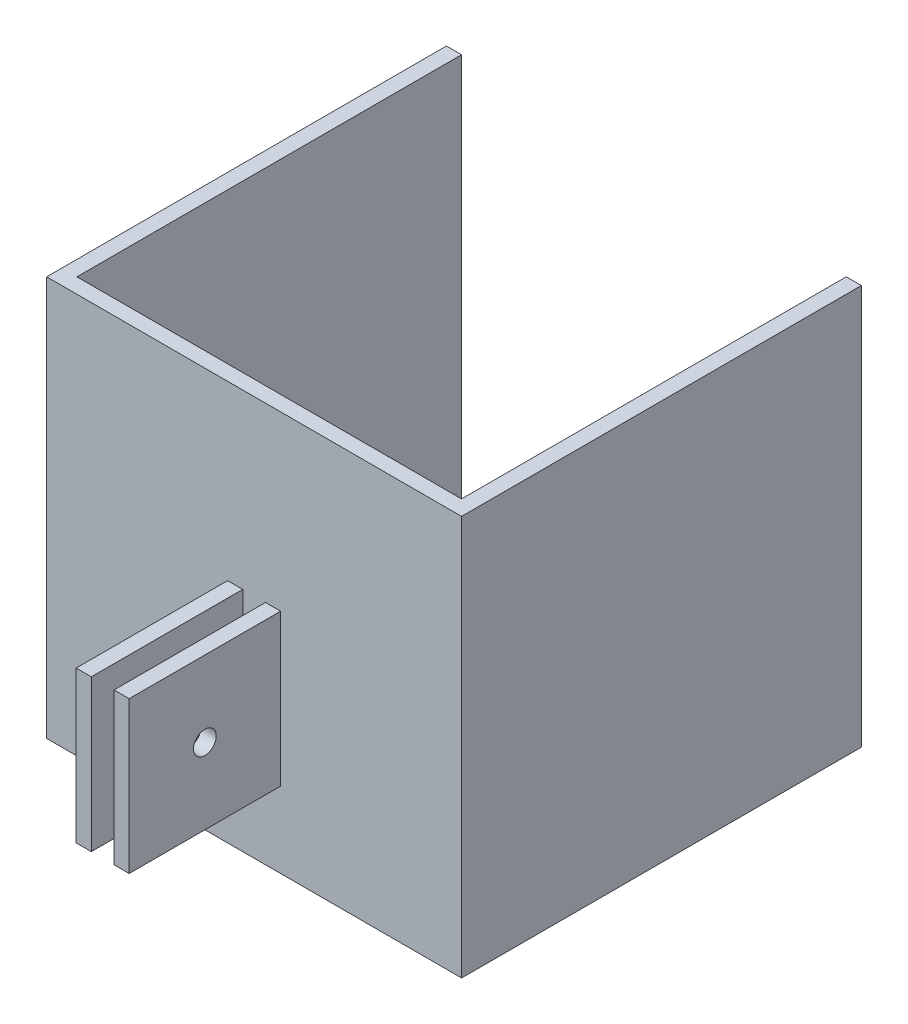
from build123d import *

# Parameters (mm, degrees)
SKETCH1_W                = 50.8
SKETCH1_H                = 50.8
BOSS_EXTRUDE1_DEPTH      = 2
BOSS_EXTRUDE2_START      = 2
BOSS_EXTRUDE2_DEPTH      = 50.8
BOSS_EXTRUDE3_DEPTH      = 10
BOSS_EXTRUDE3_DEPTH_BACK = 10
BOSS_EXTRUDE3_START      = 20
SKETCH1_4_W              = 2
SKETCH1_4_H              = 20
CUT_EXTRUDE1_REACH       = 81.519
SKETCH3_R                = 1.5


with BuildPart() as part:
    # Sketch1 → Boss-Extrude1 (new body)
    with BuildSketch(Plane(origin=(0, 0, 0), x_dir=(1, 0, 0), z_dir=(0, 1, 0))):
        Polygon((52.8, -2), (52.8, 50.8), (50.8, 50.8), (50.8, 0), (0, 0), (0, 50.8), (-2, 50.8), (-2, -2), align=None)
        with Locations((25.4, 25.4)):
            Rectangle(SKETCH1_W, SKETCH1_H)
    extrude(amount=BOSS_EXTRUDE1_DEPTH)

    # Sketch1<3> → Boss-Extrude2 (add)
    with BuildSketch(Plane(origin=(0, 0, 0), x_dir=(1, 0, 0), z_dir=(0, 1, 0)).offset(BOSS_EXTRUDE2_START)):
        Polygon((52.8, -2), (52.8, 50.8), (50.8, 50.8), (50.8, 0), (0, 0), (0, 50.8), (-2, 50.8), (-2, -2), align=None)
    extrude(amount=BOSS_EXTRUDE2_DEPTH)

    # Sketch1<4> → Boss-Extrude3 (add, two sides: drawn at the far end of the back side and taken through both)
    with BuildSketch(Plane(origin=(0, 0, 0), x_dir=(1, 0, 0), z_dir=(0, 1, 0)).offset(BOSS_EXTRUDE3_START - BOSS_EXTRUDE3_DEPTH_BACK)):
        with Locations((27.9, -12)):
            Rectangle(SKETCH1_4_W, SKETCH1_4_H)
        with Locations((22.9, -12)):
            Rectangle(SKETCH1_4_W, SKETCH1_4_H)
    extrude(amount=BOSS_EXTRUDE3_DEPTH + BOSS_EXTRUDE3_DEPTH_BACK)

    # Cut-Extrude1: up to this face of the body (flat: up to its plane)
    cut_extrude1_end = Plane(part.part.faces().sort_by_distance((21.9, 20, 12))[0])
    # Sketch3 → Cut-Extrude1 (cut, up to the picked face)
    with BuildSketch(Plane(origin=(28.9, 0, 0), x_dir=(0, 0, -1), z_dir=(1, 0, 0)), mode=Mode.PRIVATE) as cut_extrude1_sk1:
        with Locations((-12, 20)):
            Circle(SKETCH3_R)
    cut_extrude1_tool1 = split(extrude(cut_extrude1_sk1.sketch, amount=-CUT_EXTRUDE1_REACH, mode=Mode.PRIVATE), bisect_by=cut_extrude1_end, keep=Keep.BOTH, mode=Mode.PRIVATE)
    add(cut_extrude1_tool1.solids().sort_by(Axis((28.9, 20, 12), (-1, 0, 0)))[0], mode=Mode.SUBTRACT)


solid = part.part
